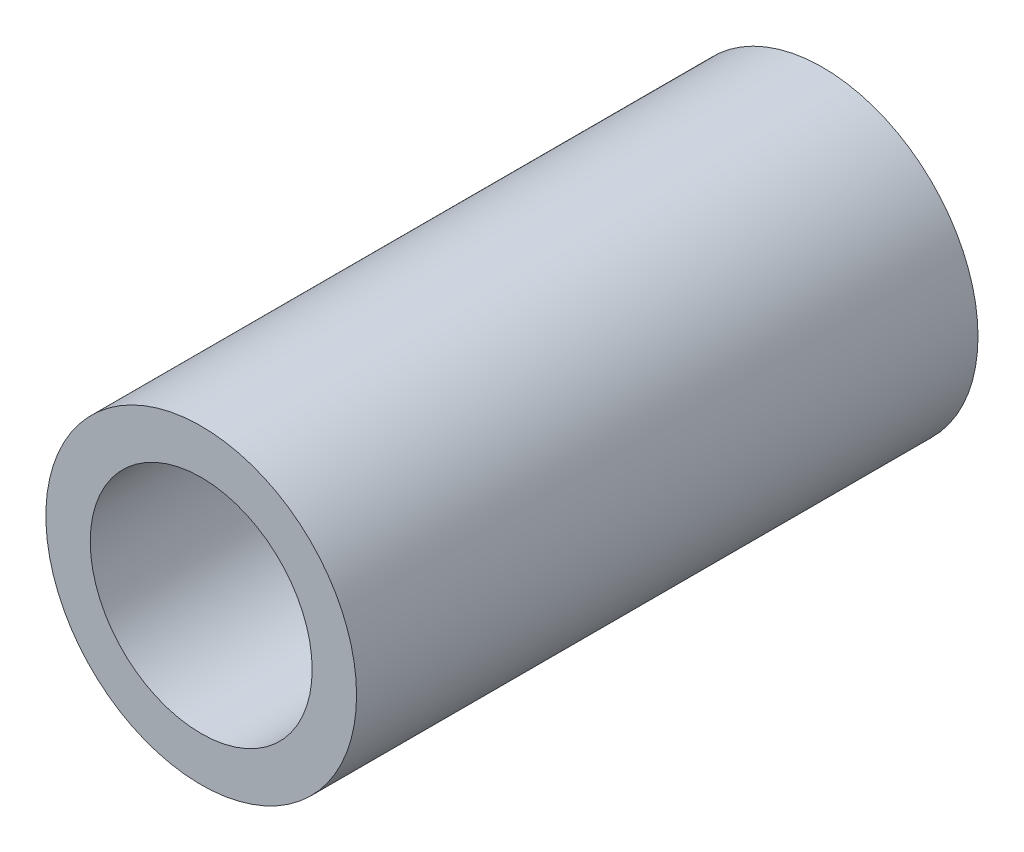
from build123d import *

# Parameters (mm, degrees)
SKETCH1_R           = 3.5
SKETCH1_R_2         = 2.5
BOSS_EXTRUDE1_DEPTH = 14


with BuildPart() as part:
    # Sketch1 → Boss-Extrude1 (new body)
    with BuildSketch(Plane.XY):
        Circle(SKETCH1_R)
        Circle(SKETCH1_R_2, mode=Mode.SUBTRACT)
    extrude(amount=BOSS_EXTRUDE1_DEPTH)


solid = part.part
